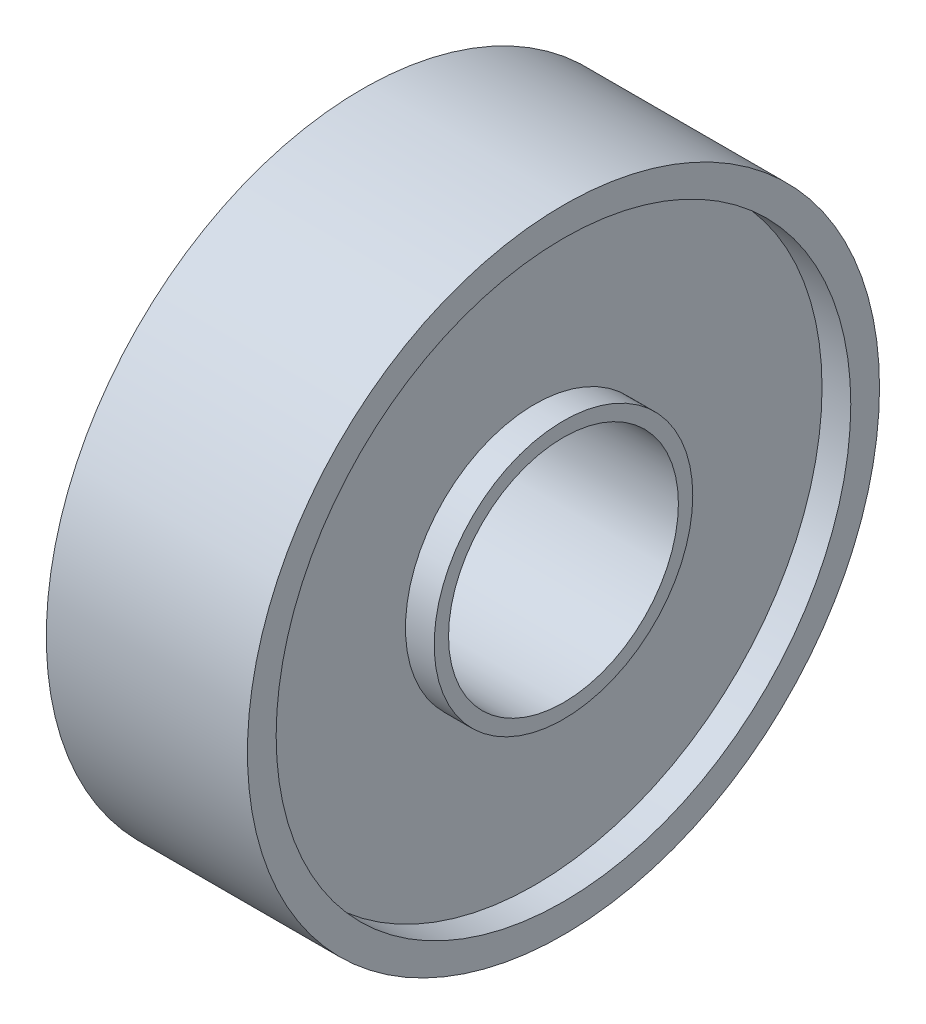
from build123d import *

# Parameters (mm, degrees)
CROQUIS1_R              = 11
CROQUIS1_R_2            = 4
SALIENTE_EXTRUIR1_DEPTH = 7
CROQUIS2_R              = 10
CROQUIS2_R_2            = 4.5
CORTAR_EXTRUIR1_DEPTH   = 1
CORTAR_EXTRUIR2_START   = -1
CROQUIS3_R              = 10
CROQUIS3_R_2            = 4.5
CORTAR_EXTRUIR2_DEPTH   = 1


with BuildPart() as part:
    # Croquis1 → Saliente-Extruir1 (new body)
    with BuildSketch(Plane(origin=(0, 0, 0), x_dir=(0, 0, -1), z_dir=(1, 0, 0))):
        Circle(CROQUIS1_R)
        Circle(CROQUIS1_R_2, mode=Mode.SUBTRACT)
    extrude(amount=SALIENTE_EXTRUIR1_DEPTH)

    # Croquis2 → Cortar-Extruir1 (cut)
    with BuildSketch(Plane(origin=(7, 0, 0), x_dir=(0, 0, -1), z_dir=(1, 0, 0))):
        Circle(CROQUIS2_R)
        Circle(CROQUIS2_R_2, mode=Mode.SUBTRACT)
    extrude(amount=-CORTAR_EXTRUIR1_DEPTH, mode=Mode.SUBTRACT)

    # Croquis3 → Cortar-Extruir2 (cut)
    with BuildSketch(Plane.ZY.offset(CORTAR_EXTRUIR2_START)):
        with Locations(Location((0, 0, 0), (0, 0, 180))):
            Circle(CROQUIS3_R)
        with Locations(Location((0, 0, 0), (0, 0, 180))):
            Circle(CROQUIS3_R_2, mode=Mode.SUBTRACT)
    extrude(amount=CORTAR_EXTRUIR2_DEPTH, mode=Mode.SUBTRACT)


solid = part.part
